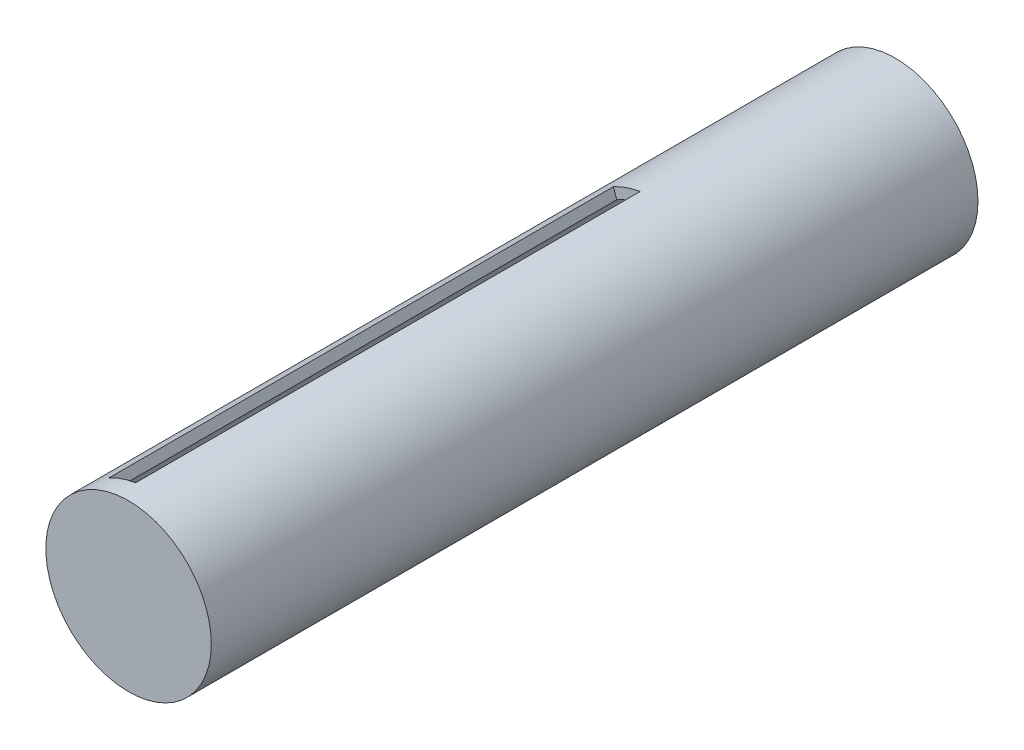
from build123d import *

# Parameters (mm, degrees)
ESQUISSE1_R             = 41
ESQUISSE1_R_2           = 36
BOSS_EXTRU_1_DEPTH      = 370
BOSS_EXTRU_2_DEPTH      = 110
ENL_V_MAT_EXTRU_1_DEPTH = 250
BOSS_EXTRU_3_START      = 10
ESQUISSE3_R             = 41
BOSS_EXTRU_3_DEPTH      = 10


with BuildPart() as part:
    # Esquisse1 → Boss.-Extru.1 (new body)
    with BuildSketch(Plane.XY):
        Circle(ESQUISSE1_R)
        Circle(ESQUISSE1_R_2, mode=Mode.SUBTRACT)
    extrude(amount=-BOSS_EXTRU_1_DEPTH)


with BuildPart() as body_2:
    # Esquisse2 → Boss.-Extru.2 (new body)
    with BuildSketch(Plane.XY):
        Polygon((-20.206852958, 37.47910209), (-6.959206174, 42.006778613), (-0.491096856, 23.081568921), (-13.73874364, 18.553892399), align=None)
    extrude(amount=-BOSS_EXTRU_2_DEPTH)


with BuildPart() as enl_v_mat_extru_1_tool:
    # Esquisse2<2> → Enlèv. mat.-Extru.1 (new body)
    with BuildSketch(Plane.XY):
        Polygon((-20.206852958, 37.47910209), (-6.959206174, 42.006778613), (-0.491096856, 23.081568921), (-13.73874364, 18.553892399), align=None)
    extrude(amount=-ENL_V_MAT_EXTRU_1_DEPTH)


with BuildPart() as part_1:
    add(part.part)

    # Enlèv. mat.-Extru.1: cut by enl_v_mat_extru_1_tool
    add(enl_v_mat_extru_1_tool.part, mode=Mode.SUBTRACT)

    # Esquisse3 → Boss.-Extru.3 (add)
    with BuildSketch(Plane.XY.offset(BOSS_EXTRU_3_START)):
        Circle(ESQUISSE3_R)
    extrude(amount=-BOSS_EXTRU_3_DEPTH)


with BuildPart() as body_2_1:
    add(body_2.part)

    # Enlèv. mat.-Extru.1: cut by enl_v_mat_extru_1_tool
    add(enl_v_mat_extru_1_tool.part, mode=Mode.SUBTRACT)


solid = part_1.part
